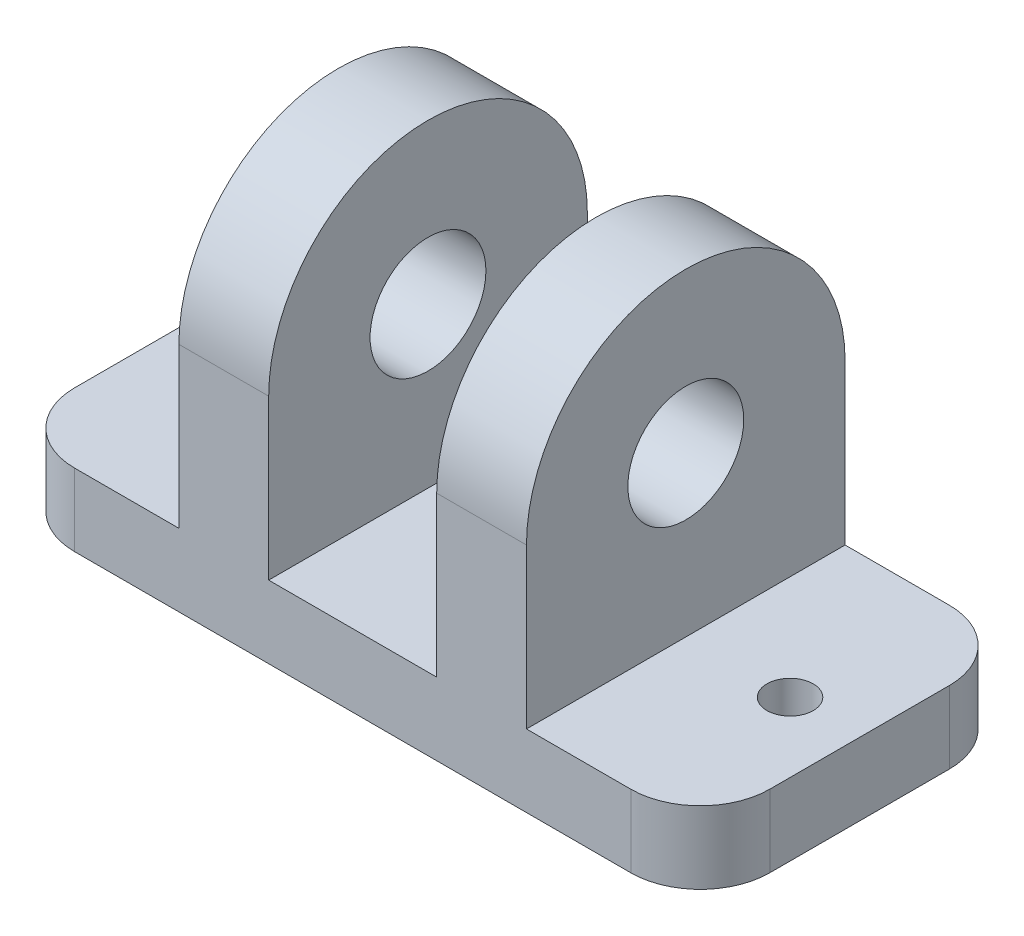
from build123d import *

# Parameters (mm, degrees)
SKETCH1_W           = 120
SKETCH1_H           = 55
BOSS_EXTRUDE1_DEPTH = 12.5
SKETCH3_W           = 15.5
SKETCH3_H           = 55
BOSS_EXTRUDE2_DEPTH = 55
SKETCH6_R           = 10
CUT_EXTRUDE1_DEPTH  = 110.001146783
CUT_EXTRUDE4_DEPTH  = 86.914201387
SKETCH8_R           = 4
CUT_EXTRUDE5_DEPTH  = 86.914201387


with BuildPart() as part:
    # Sketch1 → Boss-Extrude1 (new body)
    with BuildSketch(Plane(origin=(0, 0, 0), x_dir=(1, 0, 0), z_dir=(0, 1, 0))):
        Rectangle(SKETCH1_W, SKETCH1_H)
    extrude(amount=-BOSS_EXTRUDE1_DEPTH)

    # Sketch3 → Boss-Extrude2 (add)
    with BuildSketch(Plane(origin=(0, 0, 0), x_dir=(1, 0, 0), z_dir=(0, 1, 0))):
        with Locations((22.25, 0)):
            Rectangle(SKETCH3_W, SKETCH3_H)
        with Locations((-22.25, 0)):
            Rectangle(SKETCH3_W, SKETCH3_H)
    extrude(amount=BOSS_EXTRUDE2_DEPTH)

    # Sketch6 → Cut-Extrude1 (cut, through all)
    with BuildSketch(Plane(origin=(30, 0, 0), x_dir=(0, 0, -1), z_dir=(1, 0, 0))):
        with BuildLine():
            Line((-27.5, 55), (-27.5, 27.5))
            ThreePointArc((-27.5, 27.5), (-19.445436492, 46.945436473), (-2.7e-08, 55))
            Line((-2.7e-08, 55), (-27.5, 55))
        make_face()
        with BuildLine():
            Line((27.5, 55), (-2.7e-08, 55))
            ThreePointArc((-2.7e-08, 55), (19.445436473, 46.945436492), (27.5, 27.5))
            Line((27.5, 27.5), (27.5, 55))
        make_face()
        with Locations((0, 27.5)):
            Circle(SKETCH6_R)
    extrude(amount=-CUT_EXTRUDE1_DEPTH, mode=Mode.SUBTRACT)

    # Sketch7 → Cut-Extrude4 (cut, through all)
    with BuildSketch(Plane(origin=(0, 0, 0), x_dir=(1, 0, 0), z_dir=(0, 1, 0))):
        with BuildLine():
            Line((60, -27.5), (60, -15.5))
            ThreePointArc((60, -15.5), (56.485281374, -23.985281374), (48, -27.5))
            Line((48, -27.5), (60, -27.5))
        make_face()
        with BuildLine():
            ThreePointArc((48, 27.5), (56.485281374, 23.985281374), (60, 15.5))
            Line((60, 15.5), (60, 27.5))
            Line((60, 27.5), (48, 27.5))
        make_face()
        with BuildLine():
            Line((-60, 27.5), (-60, 15.5))
            ThreePointArc((-60, 15.5), (-56.485281374, 23.985281374), (-48, 27.5))
            Line((-48, 27.5), (-60, 27.5))
        make_face()
        with BuildLine():
            ThreePointArc((-48, -27.5), (-56.485281374, -23.985281374), (-60, -15.5))
            Line((-60, -15.5), (-60, -27.5))
            Line((-60, -27.5), (-48, -27.5))
        make_face()
    extrude(amount=-CUT_EXTRUDE4_DEPTH, mode=Mode.SUBTRACT)

    # Sketch8 → Cut-Extrude5 (cut, through all)
    with BuildSketch(Plane(origin=(0, 0, 0), x_dir=(1, 0, 0), z_dir=(0, 1, 0))):
        with Locations(Location((-48, 0, 0), (0, 0, 270))):
            Circle(SKETCH8_R)
        with Locations(Location((48, 0, 0), (0, 0, 270))):
            Circle(SKETCH8_R)
    extrude(amount=-CUT_EXTRUDE5_DEPTH, mode=Mode.SUBTRACT)


solid = part.part
